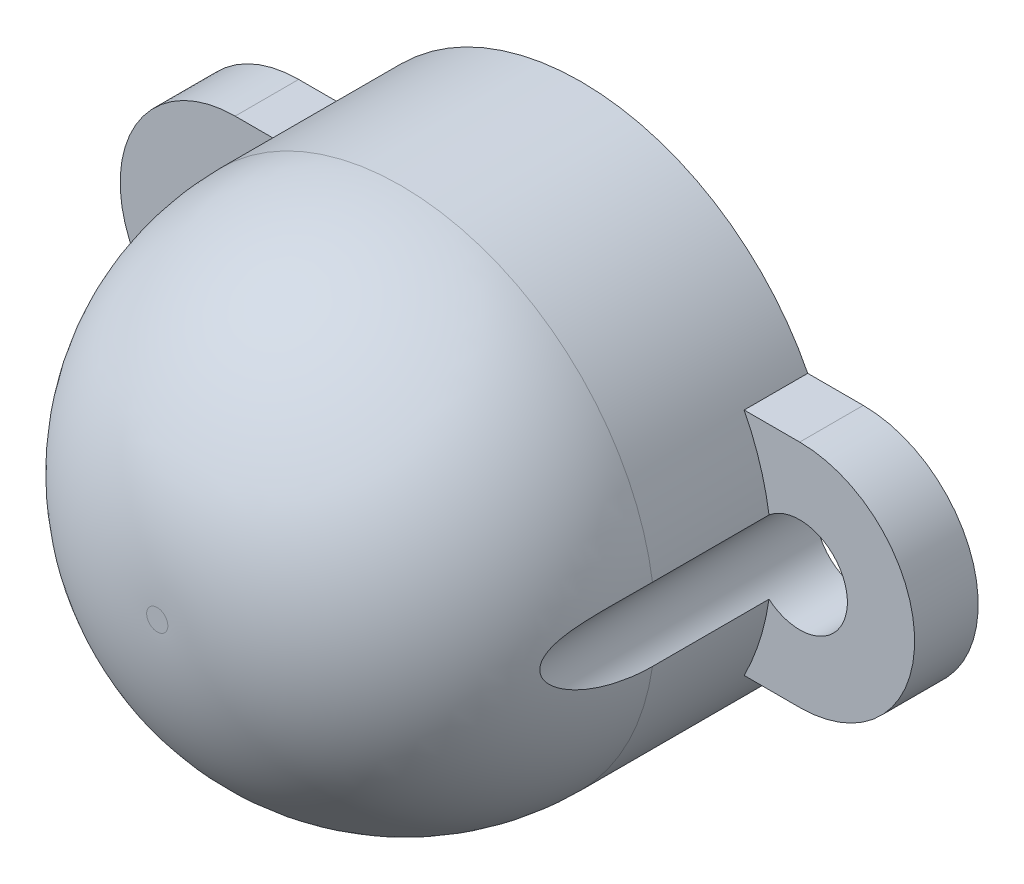
from build123d import *

# Parameters (mm, degrees)
BOSS_EXTRUDE1_DEPTH = 1.524
SKETCH4_R           = 1.143
CUT_EXTRUDE6_DEPTH  = 28.702


with BuildPart() as part:
    # Sketch1 → Boss-Extrude1 (new body)
    with BuildSketch(Plane.XY):
        with BuildLine():
            Line((6.7691, -2.7559), (-6.7691, -2.7559))
            ThreePointArc((-6.7691, -2.7559), (-9.525, 0), (-6.7691, 2.7559))
            Line((-6.7691, 2.7559), (6.7691, 2.7559))
            ThreePointArc((6.7691, 2.7559), (9.525, 0), (6.7691, -2.7559))
        make_face()
    extrude(amount=BOSS_EXTRUDE1_DEPTH)

    # Sketch2 → Revolve2 (revolve)
    with BuildSketch(Plane(origin=(0, 0, 0), x_dir=(1, 0, 0), z_dir=(0, 1, 0)), mode=Mode.PRIVATE) as revolve2_sk:
        with BuildLine():
            Line((0, 0), (6.096, 0))
            Line((6.096, 0), (6.096, -4.318))
            ThreePointArc((6.096, -4.318), (4.384917816, -8.448917816), (0.254, -10.16))
            Line((0.254, -10.16), (0, -10.16))
            Line((0, -10.16), (0, 0))
        make_face()
    revolve(revolve2_sk.sketch.rotate(Axis((0, 0, 0), (0, 0, 1)), 180), axis=Axis((0, 0, 0), (0, 0, 1)))

    # Sketch4 → Cut-Extrude6 (cut)
    with BuildSketch(Plane.XY):
        with Locations((-6.7691, 0)):
            Circle(SKETCH4_R)
        with Locations(Location((6.7691, 0, 0), (0, 0, 130.093582501))):
            Circle(SKETCH4_R)
    extrude(amount=CUT_EXTRUDE6_DEPTH, mode=Mode.SUBTRACT)


solid = part.part
